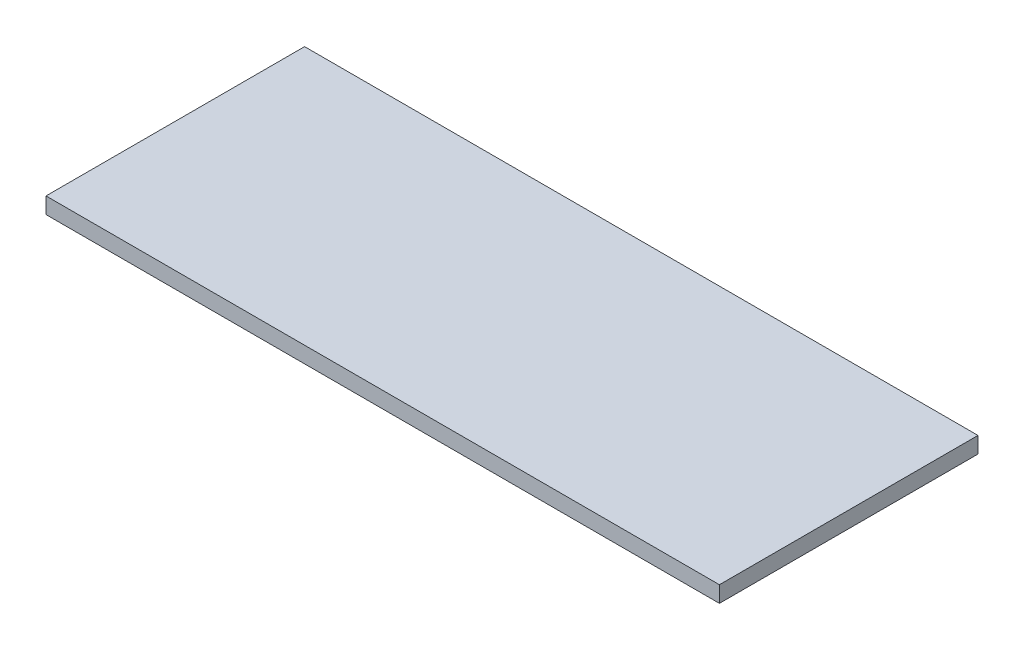
from build123d import *

# Parameters (mm, degrees)
SKETCH1_W           = 125
SKETCH1_H           = 48
BOSS_EXTRUDE1_DEPTH = 3


with BuildPart() as part:
    # Sketch1 → Boss-Extrude1 (new body)
    with BuildSketch(Plane(origin=(0, 0, 0), x_dir=(1, 0, 0), z_dir=(0, 1, 0))):
        Rectangle(SKETCH1_W, SKETCH1_H)
    extrude(amount=BOSS_EXTRUDE1_DEPTH)


solid = part.part
